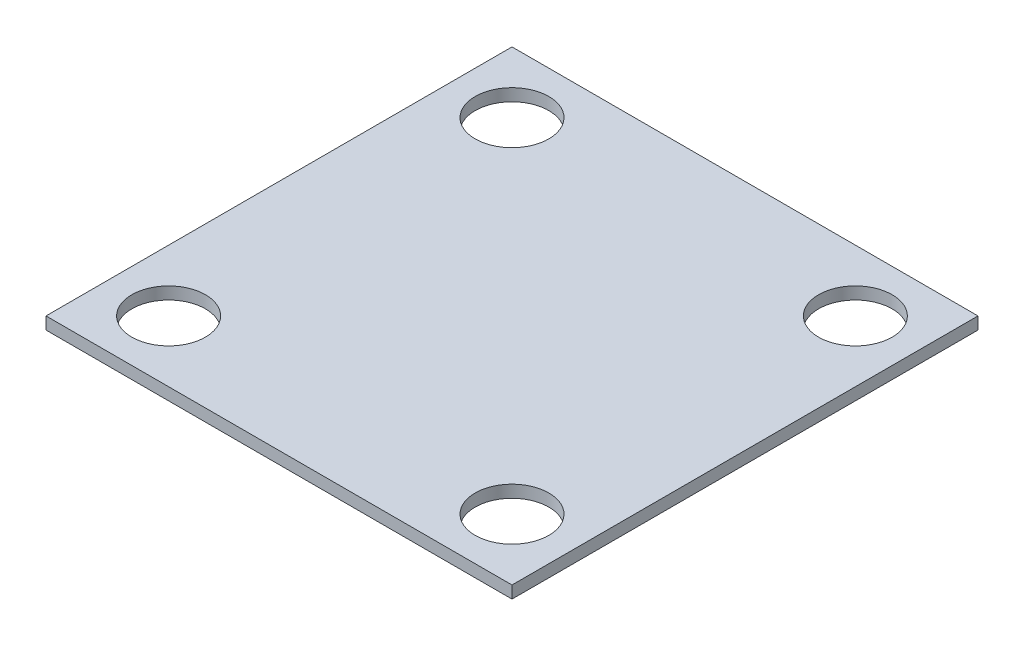
from build123d import *

# Parameters (mm, degrees)
SKETCH_1_W      = 38
SKETCH_1_H      = 38
SKETCH_1_R      = 3
EXTRUDE_1_DEPTH = 1


with BuildPart() as part:
    # Эскиз1 → Бобышка-Вытянуть1 (new body)
    with BuildSketch(Plane(origin=(0, 0, 0), x_dir=(1, 0, 0), z_dir=(0, 1, 0))):
        Rectangle(SKETCH_1_W, SKETCH_1_H)
        with Locations(Location((-14, 14, 0), (0, 0, 270))):
            Circle(SKETCH_1_R, mode=Mode.SUBTRACT)
        with Locations(Location((14, 14, 0), (0, 0, 270))):
            Circle(SKETCH_1_R, mode=Mode.SUBTRACT)
        with Locations(Location((14, -14, 0), (0, 0, 270))):
            Circle(SKETCH_1_R, mode=Mode.SUBTRACT)
        with Locations(Location((-14, -14, 0), (0, 0, 270))):
            Circle(SKETCH_1_R, mode=Mode.SUBTRACT)
    extrude(amount=EXTRUDE_1_DEPTH)


solid = part.part
